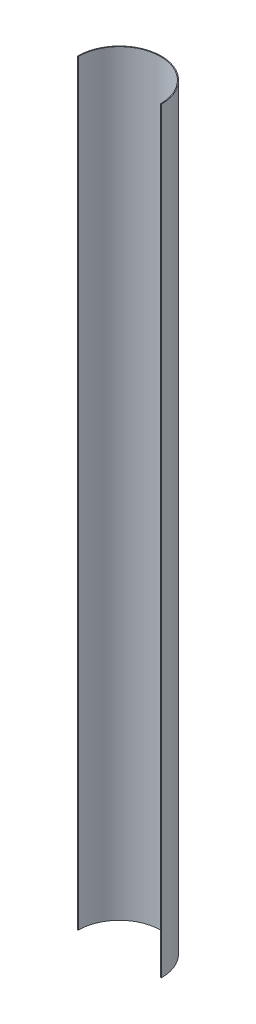
from build123d import *

# Parameters (mm, degrees)
ESQUISSE1_R             = 77.5
ESQUISSE1_R_2           = 76
BOSS_EXTRU_1_DEPTH      = 1400
ESQUISSE2_W             = 221.94810117
ESQUISSE2_H             = 120.72772872
ENL_V_MAT_EXTRU_1_DEPTH = 1400


with BuildPart() as part:
    # Esquisse1 → Boss.-Extru.1 (new body)
    with BuildSketch(Plane(origin=(0, 0, 0), x_dir=(1, 0, 0), z_dir=(0, 1, 0))):
        with Locations(Location((0, 0, 0), (0, 0, 270))):
            Circle(ESQUISSE1_R)
        with Locations(Location((0, 0, 0), (0, 0, 270))):
            Circle(ESQUISSE1_R_2, mode=Mode.SUBTRACT)
    extrude(amount=BOSS_EXTRU_1_DEPTH)

    # Esquisse2 → Enlèv. mat.-Extru.1 (cut)
    with BuildSketch(Plane.XZ):
        with Locations((-5.410315519, 60.36386436)):
            Rectangle(ESQUISSE2_W, ESQUISSE2_H)
    extrude(amount=-ENL_V_MAT_EXTRU_1_DEPTH, mode=Mode.SUBTRACT)


solid = part.part
